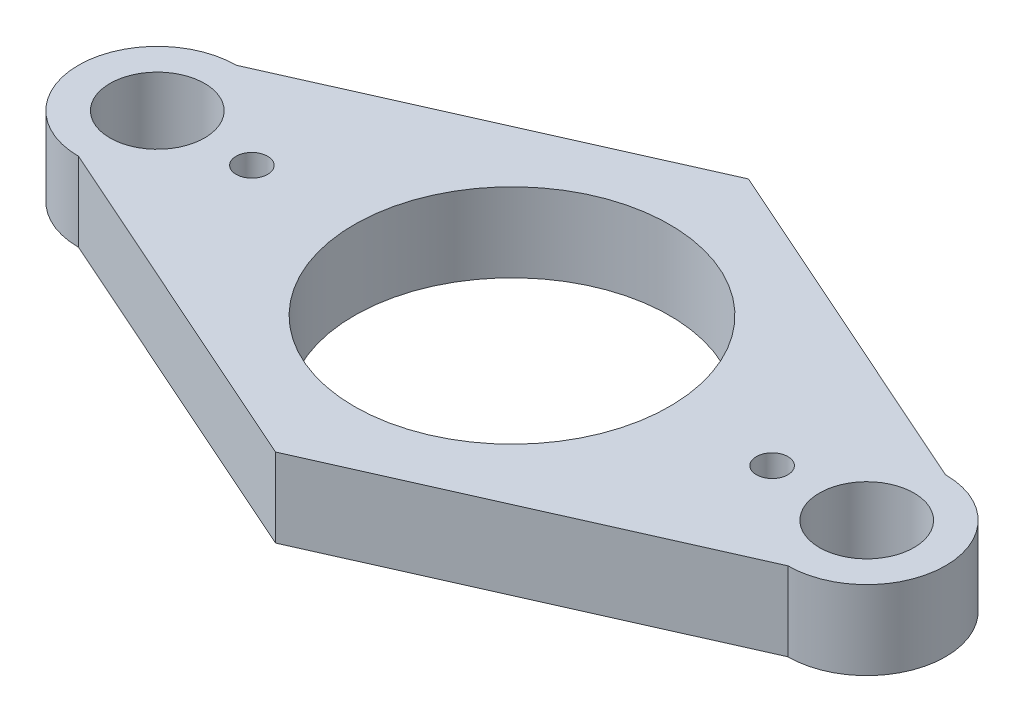
from build123d import *

# Parameters (mm, degrees)
SKETCH_1_R      = 3
SKETCH_1_R_2    = 10
SKETCH_1_R_3    = 1
EXTRUDE_1_DEPTH = 5


with BuildPart() as part:
    # Эскиз1 → Бобышка-Вытянуть1 (new body)
    with BuildSketch(Plane(origin=(0, 0, 0), x_dir=(1, 0, 0), z_dir=(0, 1, 0))):
        with BuildLine():
            Line((-22.5, 4.130728704), (0, 14.130728704))
            Line((0, 14.130728704), (22.5, 4.130728704))
            ThreePointArc((22.5, 4.130728704), (27.5, -0.869271296), (22.5, -5.869271296))
            Line((22.5, -5.869271296), (0, -15.869271296))
            Line((0, -15.869271296), (-22.5, -5.869271296))
            ThreePointArc((-22.5, -5.869271296), (-27.5, -0.869271296), (-22.5, 4.130728704))
        make_face()
        with Locations(Location((-22.5, -0.869271296, 0), (0, 0, 270))):
            Circle(SKETCH_1_R, mode=Mode.SUBTRACT)
        with Locations(Location((0, -0.869271296, 0), (0, 0, 270))):
            Circle(SKETCH_1_R_2, mode=Mode.SUBTRACT)
        with Locations(Location((22.5, -0.869271296, 0), (0, 0, 270))):
            Circle(SKETCH_1_R, mode=Mode.SUBTRACT)
        with Locations(Location((-16.5, -0.869271296, 0), (0, 0, 270))):
            Circle(SKETCH_1_R_3, mode=Mode.SUBTRACT)
        with Locations(Location((16.5, -0.869271296, 0), (0, 0, 270))):
            Circle(SKETCH_1_R_3, mode=Mode.SUBTRACT)
    extrude(amount=EXTRUDE_1_DEPTH)


solid = part.part
